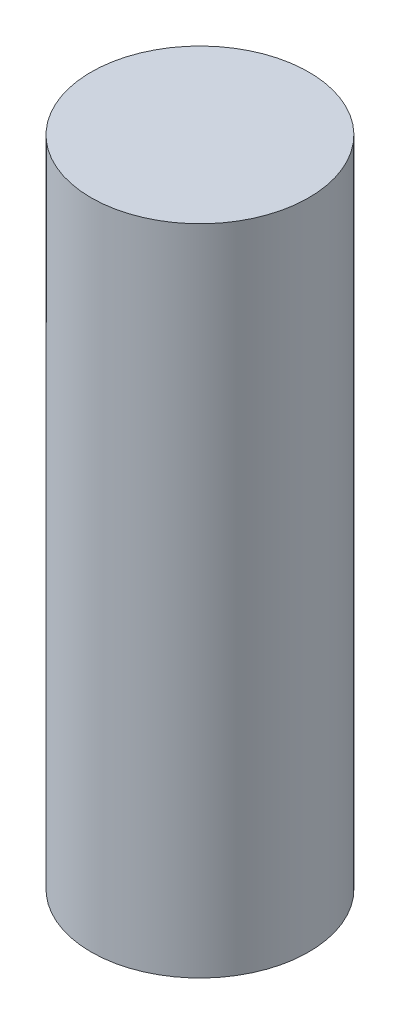
from build123d import *

# Parameters (mm, degrees)
SKETCH1_R           = 10
BOSS_EXTRUDE1_DEPTH = 60


with BuildPart() as part:
    # Sketch1 → Boss-Extrude1 (new body)
    with BuildSketch(Plane(origin=(0, 0, 0), x_dir=(1, 0, 0), z_dir=(0, 1, 0))):
        with Locations(Location((-37.230780293, 22.710775979, 0), (0, 0, 270))):
            Circle(SKETCH1_R)
    extrude(amount=BOSS_EXTRUDE1_DEPTH)


solid = part.part
